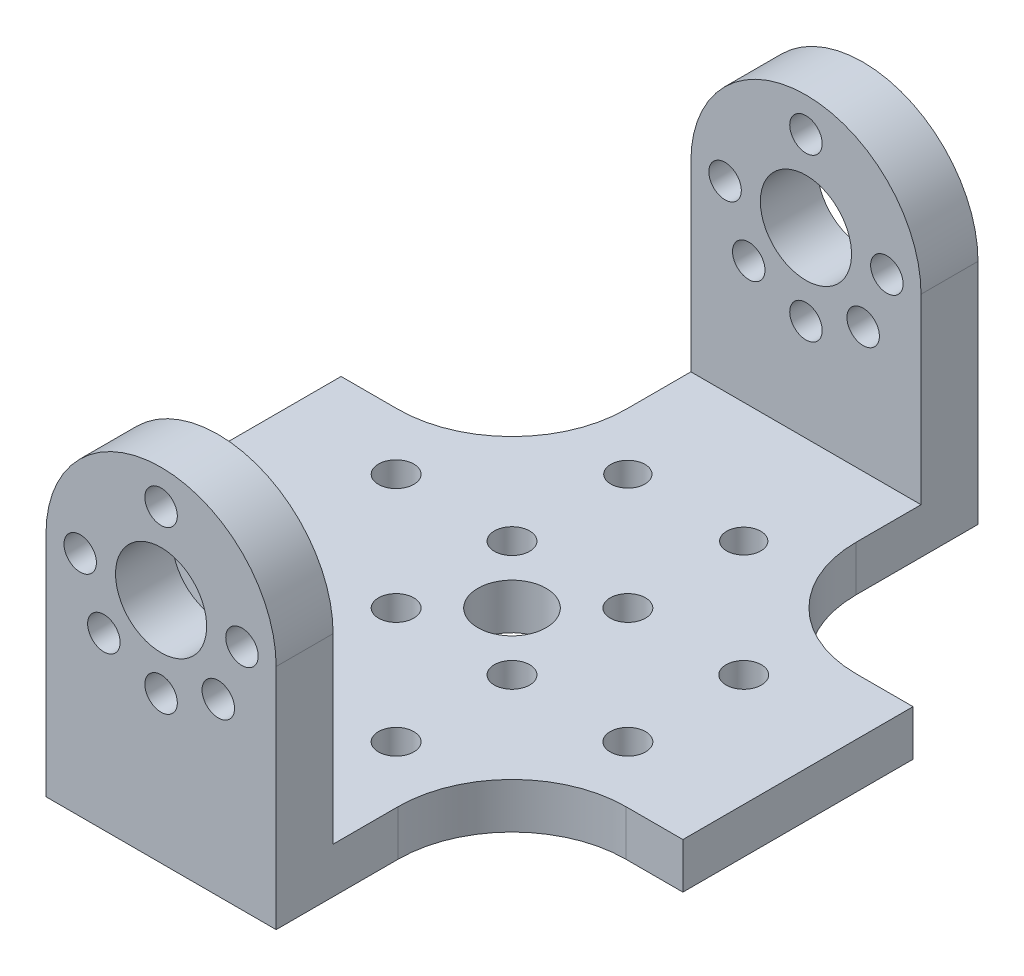
from build123d import *

# Parameters (mm, degrees)
SKETCH1_R           = 4
SKETCH1_R_2         = 1.425
BOSS_EXTRUDE1_DEPTH = 61.6
CUT_EXTRUDE1_DEPTH  = 55.6
SKETCH3_R           = 3
SKETCH3_R_2         = 1.55
SKETCH3_R_3         = 1.5
CUT_EXTRUDE2_DEPTH  = 10
SKETCH4_W           = 20.2
SKETCH4_H           = 51.6
SKETCH4_R           = 3
SKETCH4_R_2         = 1.55
SKETCH4_R_3         = 1.5
BOSS_EXTRUDE2_DEPTH = 2
SKETCH5_W           = 15
SKETCH5_H           = 20.2
BOSS_EXTRUDE3_DEPTH = 4
SKETCH6_R           = 1.55
CUT_EXTRUDE3_DEPTH  = 4
FILLET1_R           = 10


with BuildPart() as part:
    # Sketch1 → Boss-Extrude1 (new body)
    with BuildSketch(Plane.XY):
        with BuildLine():
            Line((-10.1, 0), (-10.1, -20))
            Line((-10.1, -20), (10.1, -20))
            Line((10.1, -20), (10.1, 0))
            ThreePointArc((10.1, 0), (0, 10.1), (-10.1, 0))
        make_face()
        Circle(SKETCH1_R, mode=Mode.SUBTRACT)
        with Locations((0, 7.1)):
            Circle(SKETCH1_R_2, mode=Mode.SUBTRACT)
        with Locations((7.1, 0)):
            Circle(SKETCH1_R_2, mode=Mode.SUBTRACT)
        with Locations((5.020458146, -5.020458146)):
            Circle(SKETCH1_R_2, mode=Mode.SUBTRACT)
        with Locations((0, -7.1)):
            Circle(SKETCH1_R_2, mode=Mode.SUBTRACT)
        with Locations((-5.020458146, -5.020458146)):
            Circle(SKETCH1_R_2, mode=Mode.SUBTRACT)
        with Locations((-7.1, 0)):
            Circle(SKETCH1_R_2, mode=Mode.SUBTRACT)
    extrude(amount=BOSS_EXTRUDE1_DEPTH)

    # Sketch2 → Cut-Extrude1 (cut)
    with BuildSketch(Plane(origin=(10.1, 0, 0), x_dir=(0, 0, -1), z_dir=(1, 0, 0))):
        Polygon((-11.799884689, -18), (-56.6, -18), (-56.6, 10.1), (-5, 10.1), (-5, -18), align=None)
    extrude(amount=-CUT_EXTRUDE1_DEPTH, mode=Mode.SUBTRACT)

    # Sketch3 → Cut-Extrude2 (cut)
    with BuildSketch(Plane.XZ.offset(20)):
        with Locations((0, 30.8)):
            Circle(SKETCH3_R)
        with Locations((-5.084097757, 35.884097757)):
            Circle(SKETCH3_R_2)
        with Locations((5.084097757, 35.884097757)):
            Circle(SKETCH3_R_2)
        with Locations((5.084097757, 25.715902243)):
            Circle(SKETCH3_R_2)
        with Locations((-5.084097757, 25.715902243)):
            Circle(SKETCH3_R_2)
        with Locations((-5.084097757, 46.054097757)):
            Circle(SKETCH3_R_2)
        with Locations((5.084097757, 46.054097757)):
            Circle(SKETCH3_R_2)
        with Locations((-5.084097757, 15.545902243)):
            Circle(SKETCH3_R_3)
        with Locations((5.084097757, 15.545902243)):
            Circle(SKETCH3_R_3)
    extrude(amount=-CUT_EXTRUDE2_DEPTH, mode=Mode.SUBTRACT)

    # Sketch4 → Boss-Extrude2 (add)
    with BuildSketch(Plane(origin=(0, -18, 0), x_dir=(1, 0, 0), z_dir=(0, 1, 0))):
        with Locations((0, -30.8)):
            Rectangle(SKETCH4_W, SKETCH4_H)
        with Locations((0, -30.8)):
            Circle(SKETCH4_R, mode=Mode.SUBTRACT)
        with Locations((-5.084097757, -25.715902243)):
            Circle(SKETCH4_R_2, mode=Mode.SUBTRACT)
        with Locations((5.084097757, -25.715902243)):
            Circle(SKETCH4_R_2, mode=Mode.SUBTRACT)
        with Locations((5.084097757, -15.545902243)):
            Circle(SKETCH4_R_3, mode=Mode.SUBTRACT)
        with Locations((-5.084097757, -15.545902243)):
            Circle(SKETCH4_R_3, mode=Mode.SUBTRACT)
        with Locations((-5.084097757, -35.884097757)):
            Circle(SKETCH4_R_2, mode=Mode.SUBTRACT)
        with Locations((5.084097757, -35.884097757)):
            Circle(SKETCH4_R_2, mode=Mode.SUBTRACT)
        with Locations((-5.084097757, -46.054097757)):
            Circle(SKETCH4_R_2, mode=Mode.SUBTRACT)
        with Locations((5.084097757, -46.054097757)):
            Circle(SKETCH4_R_2, mode=Mode.SUBTRACT)
    extrude(amount=BOSS_EXTRUDE2_DEPTH)

    # Sketch5 → Boss-Extrude3 (add)
    with BuildSketch(Plane(origin=(0, -20, 0), x_dir=(-1, 0, 0), z_dir=(0, -1, 0))):
        with Locations((17.6, -30.8)):
            Rectangle(SKETCH5_W, SKETCH5_H)
        with Locations((-17.6, -30.8)):
            Rectangle(SKETCH5_W, SKETCH5_H)
    extrude(amount=-BOSS_EXTRUDE3_DEPTH)

    # Sketch6 → Cut-Extrude3 (cut)
    with BuildSketch(Plane(origin=(0, -20, 0), x_dir=(-1, 0, 0), z_dir=(0, -1, 0))):
        with Locations((15.254097757, -25.715902243)):
            Circle(SKETCH6_R)
        with Locations((15.254097757, -35.884097757)):
            Circle(SKETCH6_R)
        with Locations((-15.254097757, -25.715902243)):
            Circle(SKETCH6_R)
        with Locations((-15.254097757, -35.884097757)):
            Circle(SKETCH6_R)
    extrude(amount=-CUT_EXTRUDE3_DEPTH, mode=Mode.SUBTRACT)

    # Fillet1
    fillet1_edges = [part.edges().sort_by_distance(p)[0] for p in [
        (-10.1, -18, 20.7),
        (-10.1, -18, 40.9),
        (10.1, -18, 40.9),
        (10.1, -18, 20.7),
    ]]
    fillet(fillet1_edges, radius=FILLET1_R)


solid = part.part
